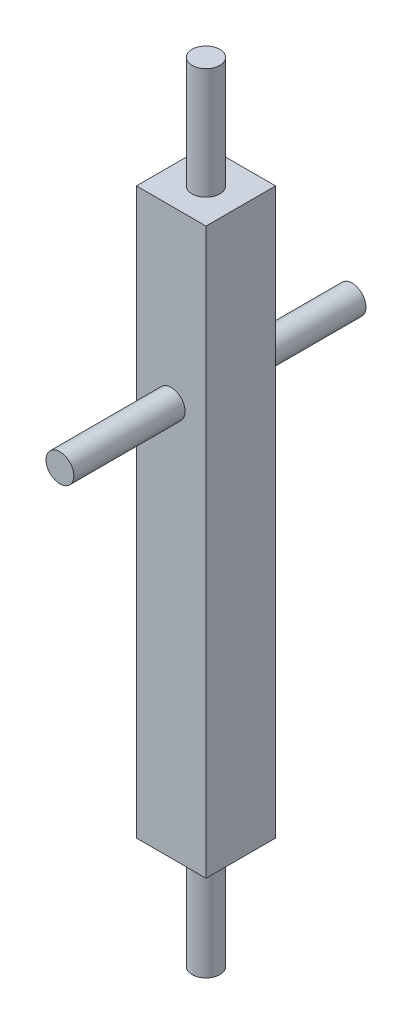
from build123d import *

# Parameters (mm, degrees)
SKETCH3_W                = 25
SKETCH3_H                = 25
SKETCH3_W_2              = 22
SKETCH3_H_2              = 22
BOSS_EXTRUDE1_DEPTH      = 200
SKETCH4_R                = 5
CUT_EXTRUDE1_DEPTH       = 25
BOSS_EXTRUDE2_DEPTH      = 52.5
BOSS_EXTRUDE2_DEPTH_BACK = 52.5
SKETCH5_R                = 5
SKETCH6_W                = 25
SKETCH6_H                = 25
BOSS_EXTRUDE3_DEPTH      = 1.5
SKETCH7_W                = 25
SKETCH7_H                = 25
BOSS_EXTRUDE4_DEPTH      = 1.5
SKETCH8_R                = 5
BOSS_EXTRUDE5_DEPTH      = 40
BOSS_EXTRUDE6_START      = 40
SKETCH9_R                = 5
BOSS_EXTRUDE6_DEPTH      = 40


with BuildPart() as part:
    # Sketch3 → Boss-Extrude1 (new body)
    with BuildSketch(Plane(origin=(0, 0, 0), x_dir=(1, 0, 0), z_dir=(0, 1, 0))):
        Rectangle(SKETCH3_W, SKETCH3_H)
        Rectangle(SKETCH3_W_2, SKETCH3_H_2, mode=Mode.SUBTRACT)
    extrude(amount=BOSS_EXTRUDE1_DEPTH)

    # Sketch4 → Cut-Extrude1 (cut)
    with BuildSketch(Plane.XY.offset(12.5)):
        with Locations((0, 140)):
            Circle(SKETCH4_R)
    extrude(amount=-CUT_EXTRUDE1_DEPTH, mode=Mode.SUBTRACT)

    # Sketch5 → Boss-Extrude2 (add, two sides: drawn at the far end of the back side and taken through both)
    with BuildSketch(Plane.XY.offset(-BOSS_EXTRUDE2_DEPTH_BACK)):
        with Locations((0, 140)):
            Circle(SKETCH5_R)
    extrude(amount=BOSS_EXTRUDE2_DEPTH + BOSS_EXTRUDE2_DEPTH_BACK)

    # Sketch6 → Boss-Extrude3 (add)
    with BuildSketch(Plane(origin=(0, 200, 0), x_dir=(1, 0, 0), z_dir=(0, 1, 0))):
        Rectangle(SKETCH6_W, SKETCH6_H)
    extrude(amount=BOSS_EXTRUDE3_DEPTH)

    # Sketch7 → Boss-Extrude4 (add)
    with BuildSketch(Plane.XZ):
        Rectangle(SKETCH7_W, SKETCH7_H)
    extrude(amount=BOSS_EXTRUDE4_DEPTH)

    # Sketch8 → Boss-Extrude5 (add)
    with BuildSketch(Plane.XZ.offset(1.5)):
        with Locations(Location((0, 0, 0), (0, 0, 270))):
            Circle(SKETCH8_R)
    extrude(amount=BOSS_EXTRUDE5_DEPTH)

    # Sketch9 → Boss-Extrude6 (add)
    with BuildSketch(Plane(origin=(0, 201.5, 0), x_dir=(1, 0, 0), z_dir=(0, 1, 0)).offset(BOSS_EXTRUDE6_START)):
        with Locations(Location((0, 0, 0), (0, 0, 90))):
            Circle(SKETCH9_R)
    extrude(amount=-BOSS_EXTRUDE6_DEPTH)


solid = part.part
